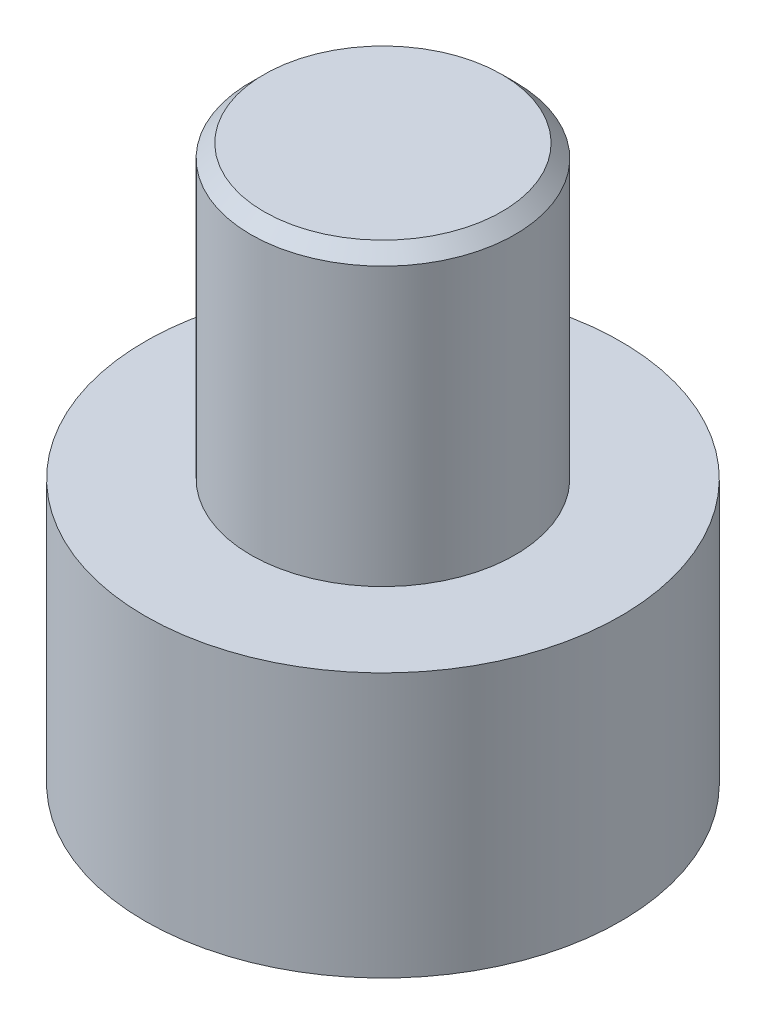
from build123d import *

# Parameters (mm, degrees)
ZKOSEN_1_SIZE = 0.5


with BuildPart() as part:
    # Skica1 → Rotovat1 (revolve)
    with BuildSketch(Plane.XY, mode=Mode.PRIVATE) as rotovat1_sk:
        Polygon((0, 0), (-9, 0), (-9, 10), (-5, 10), (-5, 21), (0, 21), align=None)
    revolve(rotovat1_sk.sketch.rotate(Axis((0, 21, 0), (0, -1, 0)), 270), axis=Axis((0, 21, 0), (0, -1, 0)))

    # Zkosení1
    zkosen_1_edges = [part.edges().sort_by_distance(p)[0] for p in [
        (0, 21, -5),
    ]]
    chamfer(zkosen_1_edges, length=ZKOSEN_1_SIZE)


solid = part.part
